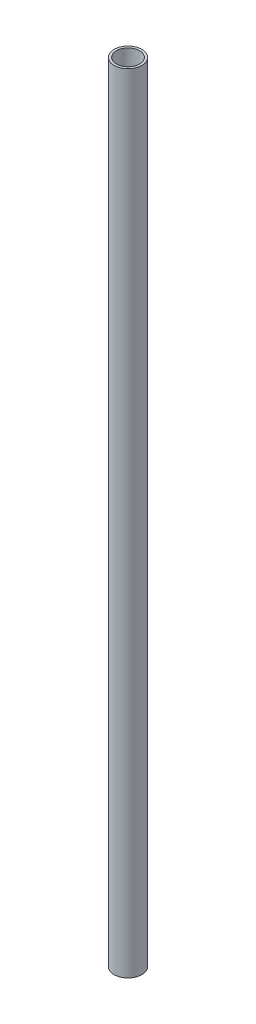
from build123d import *

# Parameters (mm, degrees)
SKETCH_1_R      = 6
SKETCH_1_R_2    = 5
EXTRUDE_1_DEPTH = 340


with BuildPart() as part:
    # 草图1 → 凸台-拉伸1 (new body)
    with BuildSketch(Plane(origin=(0, 0, 0), x_dir=(1, 0, 0), z_dir=(0, 1, 0))):
        with Locations(Location((0, 0, 0), (0, 0, 270))):
            Circle(SKETCH_1_R)
        with Locations(Location((0, 0, 0), (0, 0, 270))):
            Circle(SKETCH_1_R_2, mode=Mode.SUBTRACT)
    extrude(amount=EXTRUDE_1_DEPTH)


solid = part.part
